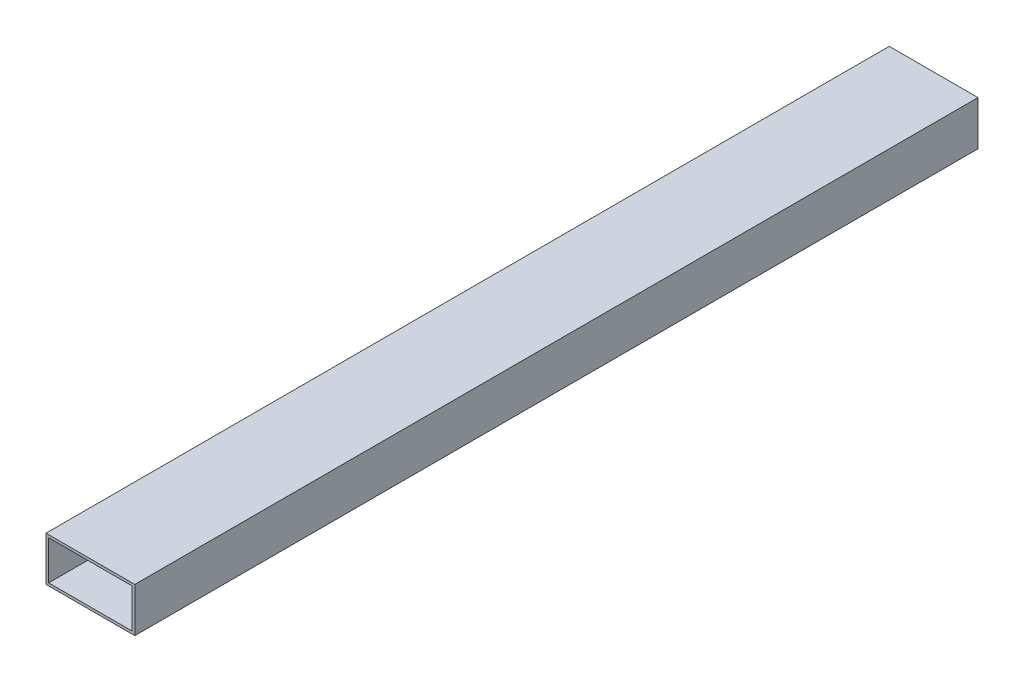
from build123d import *

# Parameters (mm, degrees)
SKETCH1_W           = 50.8
SKETCH1_H           = 25.4
SKETCH1_W_2         = 47.752
SKETCH1_H_2         = 22.352
EXTRUDE_THIN1_DEPTH = 482.6


with BuildPart() as part:
    # Sketch1 → Extrude-Thin1 (new body)
    with BuildSketch(Plane.XY):
        with Locations((-25.4, 12.7)):
            Rectangle(SKETCH1_W, SKETCH1_H)
        with Locations((-25.4, 12.7)):
            Rectangle(SKETCH1_W_2, SKETCH1_H_2, mode=Mode.SUBTRACT)
    extrude(amount=EXTRUDE_THIN1_DEPTH)


solid = part.part
